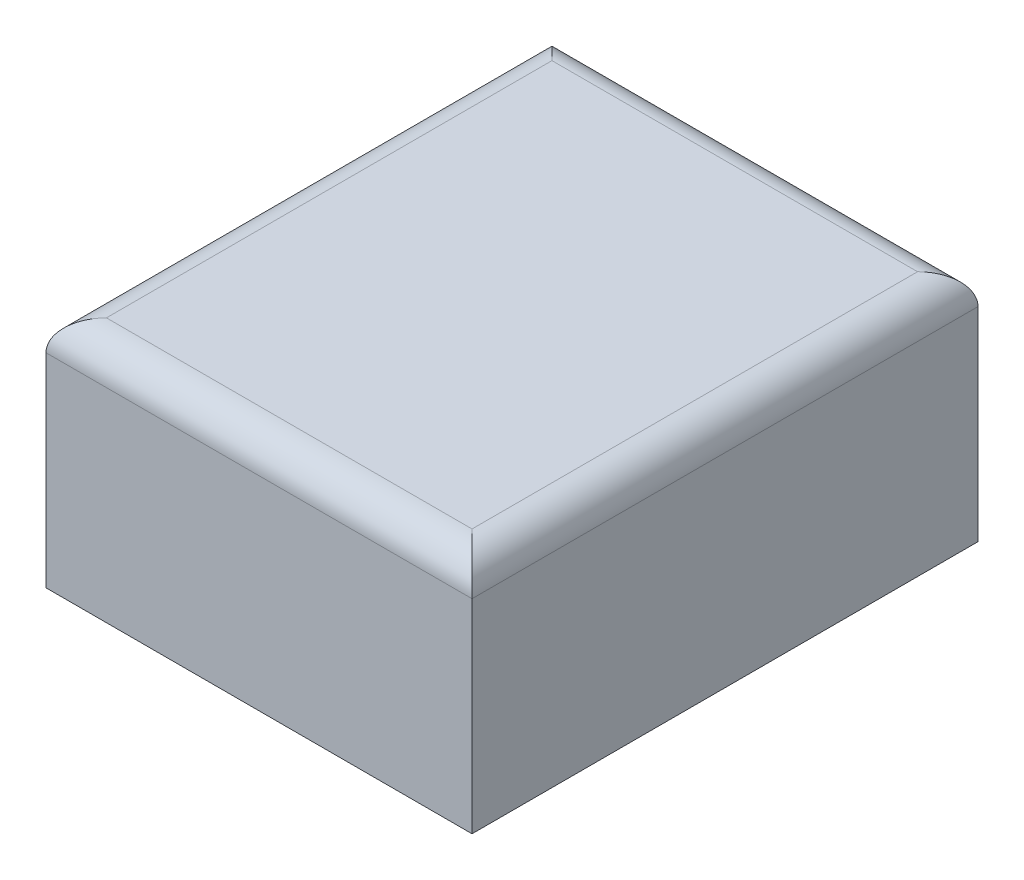
from build123d import *

# Parameters (mm, degrees)
SKETCH2_W           = 70.519509
SKETCH2_H           = 83.748079
BOSS_EXTRUDE1_DEPTH = 38.7
FILLET1_R           = 5


with BuildPart() as part:
    # Sketch2 → Boss-Extrude1 (new body)
    with BuildSketch(Plane(origin=(0, 0, 0), x_dir=(1, 0, 0), z_dir=(0, 1, 0))):
        Rectangle(SKETCH2_W, SKETCH2_H)
    extrude(amount=BOSS_EXTRUDE1_DEPTH)

    # Fillet1
    fillet1_edges = [part.edges().sort_by_distance(p)[0] for p in [
        (35.2597545, 38.7, 0),
        (0, 38.7, -41.8740395),
        (-35.2597545, 38.7, 0),
        (0, 38.7, 41.8740395),
    ]]
    fillet(fillet1_edges, radius=FILLET1_R)


solid = part.part
